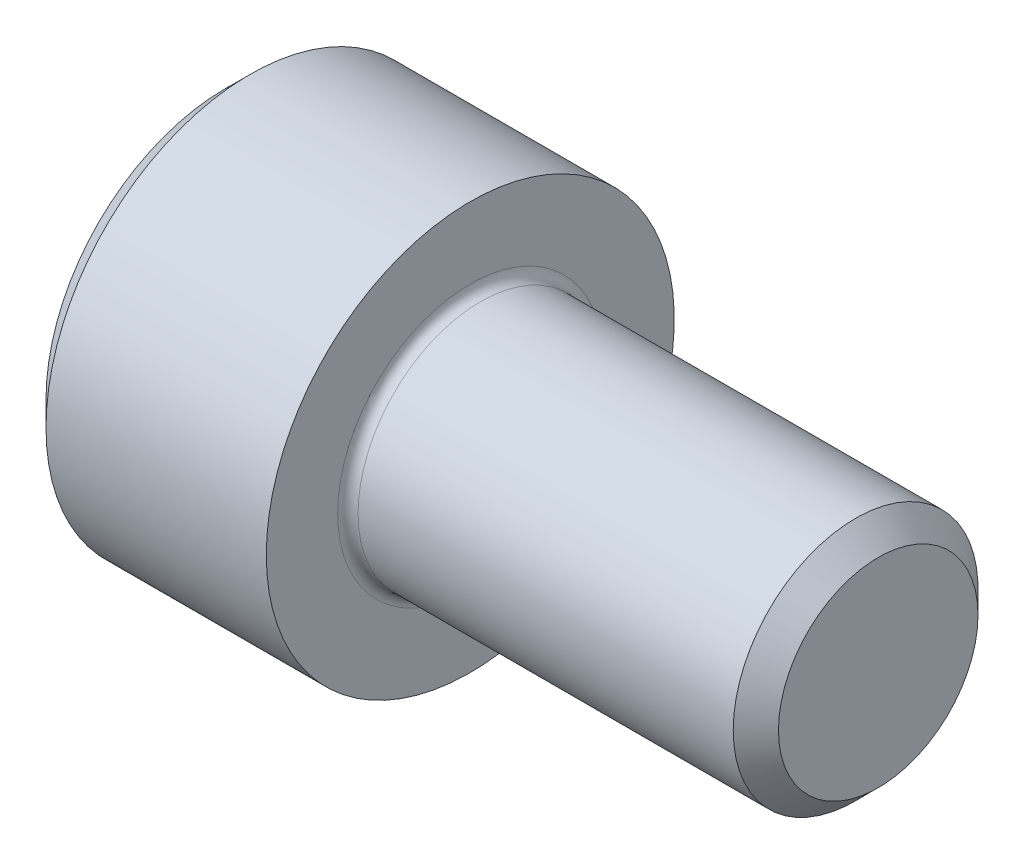
from build123d import *

# Parameters (mm, degrees)
FILLET1_R   = 0.25
HEX_2_DEPTH = 3


with BuildPart() as part:
    # BodySke → Base-Revolve (revolve)
    with BuildSketch(Plane.XY, mode=Mode.PRIVATE) as base_revolve_sk:
        Polygon((0, 0), (0, 4.4), (0.6, 5), (6, 5), (6, 3), (15.4455, 3), (16, 2.4455), (16, 0), align=None)
    revolve(base_revolve_sk.sketch.rotate(Axis((-31.75, 0, 0), (1, 0, 0)), 90), axis=Axis((-31.75, 0, 0), (1, 0, 0)))

    # Fillet1
    fillet1_edges = [part.edges().sort_by_distance(p)[0] for p in [
        (6, 0, -3),
    ]]
    fillet(fillet1_edges, radius=FILLET1_R)

    # Sketch2 → Hex-PreBroach (revolve, cut)
    with BuildSketch(Plane.XY, mode=Mode.PRIVATE) as hex_prebroach_sk:
        Polygon((0, 2.542), (3, 2.542), (4.467624384, 0), (0, 0), align=None)
    revolve(hex_prebroach_sk.sketch.rotate(Axis((0, 0, 0), (1, 0, 0)), 90), axis=Axis((0, 0, 0), (1, 0, 0)), mode=Mode.SUBTRACT)

    # Sketch3 → Hex 2 (cut)
    with BuildSketch(Plane(origin=(0, 0, 0), x_dir=(0, 0.500000000000001, 0.866025403784438), z_dir=(-1, 0, 0))):
        Polygon((1.467624384, 2.542), (-1.467624384, 2.542), (-2.935248769, 0), (-1.467624384, -2.542), (1.467624384, -2.542), (2.935248769, 0), align=None)
    extrude(amount=-HEX_2_DEPTH, mode=Mode.SUBTRACT)


solid = part.part
